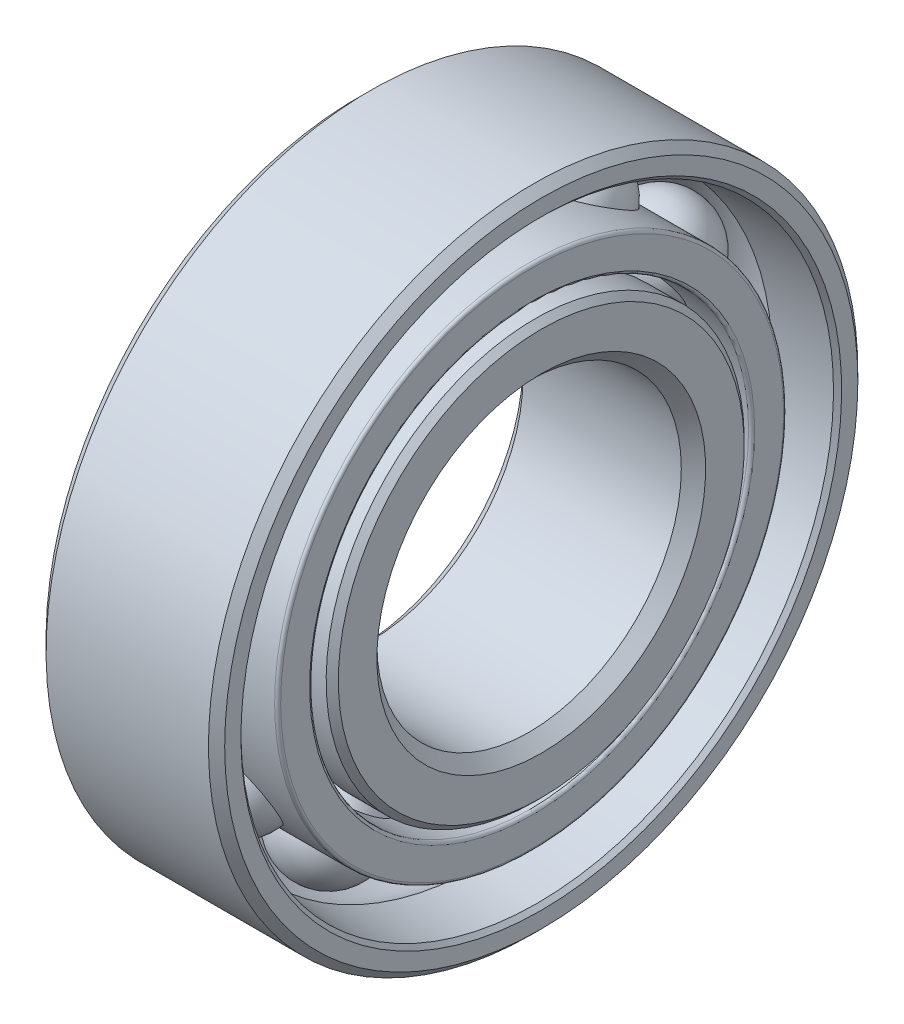
from build123d import *

# Parameters (mm, degrees)
CIRPATTERN1_COUNT   = 12
SKETCH6_R           = 12.54
SKETCH6_R_2         = 10.815
BOSS_EXTRUDE1_DEPTH = 4.05
CIRPATTERN2_COUNT   = 12
FILLET1_R           = 0.15


with BuildPart() as part:
    # Sketch3 → Revolve1 (revolve)
    with BuildSketch(Plane.XY, mode=Mode.PRIVATE) as revolve1_sk:
        with BuildLine():
            Line((4.1, 16), (-3.9, 16))
            Line((-3.9, 16), (-4.5, 15.4))
            Line((-4.5, 15.4), (-4.5, 13.5))
            Line((-4.5, 13.5), (-4.2, 13.2))
            Line((-4.2, 13.2), (-2.565891605, 13.2))
            ThreePointArc((-2.565891605, 13.2), (-1.511935823, 14.367227232), (0, 14.8))
            ThreePointArc((0, 14.8), (0.786327254, 14.689677077), (1.511935823, 14.367227232))
            Line((1.511935823, 14.367227232), (4.3, 14.6))
            Line((4.3, 14.6), (4.5, 14.8))
            Line((4.5, 14.8), (4.5, 15.6))
            Line((4.5, 15.6), (4.1, 16))
        make_face()
        with BuildLine():
            Line((3.9, 7.5), (-3.9, 7.5))
            Line((-3.9, 7.5), (-4.5, 8.1))
            Line((-4.5, 8.1), (-4.5, 10))
            Line((-4.5, 10), (-4.2, 10.3))
            Line((-4.2, 10.3), (-2.338148144, 10.3))
            ThreePointArc((-2.338148144, 10.3), (0, 9.085125168), (2.338148144, 10.3))
            Line((2.338148144, 10.3), (4.2, 10.3))
            Line((4.2, 10.3), (4.5, 10))
            Line((4.5, 10), (4.5, 8.1))
            Line((4.5, 8.1), (3.9, 7.5))
        make_face()
    revolve(revolve1_sk.sketch.rotate(Axis((-4.5, 0, 0), (1, 0, 0)), 180), axis=Axis((-4.5, 0, 0), (1, 0, 0)))


with BuildPart() as body_2:
    # Sketch5 → Revolve2 (revolve)
    with BuildSketch(Plane.XY):
        with BuildLine():
            Line((0, 14.323562584), (0, 9.561562584))
            ThreePointArc((0, 9.561562584), (2.381, 11.942562584), (0, 14.323562584))
        make_face()
    revolve(axis=Axis((0, -16, 0), (0, 1, 0)))


with BuildPart() as cirpattern1_1:
    # CirPattern1: pattern copy
    add(body_2.part.rotate(Axis((0, 0, 0), (1, 0, 0)), 1 * 360 / CIRPATTERN1_COUNT))


with BuildPart() as cirpattern1_2:
    # CirPattern1: pattern copy
    add(body_2.part.rotate(Axis((0, 0, 0), (1, 0, 0)), 2 * 360 / CIRPATTERN1_COUNT))


with BuildPart() as cirpattern1_3:
    # CirPattern1: pattern copy
    add(body_2.part.rotate(Axis((0, 0, 0), (1, 0, 0)), 3 * 360 / CIRPATTERN1_COUNT))


with BuildPart() as cirpattern1_4:
    # CirPattern1: pattern copy
    add(body_2.part.rotate(Axis((0, 0, 0), (1, 0, 0)), 4 * 360 / CIRPATTERN1_COUNT))


with BuildPart() as cirpattern1_5:
    # CirPattern1: pattern copy
    add(body_2.part.rotate(Axis((0, 0, 0), (1, 0, 0)), 5 * 360 / CIRPATTERN1_COUNT))


with BuildPart() as cirpattern1_6:
    # CirPattern1: pattern copy
    add(body_2.part.rotate(Axis((0, 0, 0), (1, 0, 0)), 6 * 360 / CIRPATTERN1_COUNT))


with BuildPart() as cirpattern1_7:
    # CirPattern1: pattern copy
    add(body_2.part.rotate(Axis((0, 0, 0), (1, 0, 0)), 7 * 360 / CIRPATTERN1_COUNT))


with BuildPart() as cirpattern1_8:
    # CirPattern1: pattern copy
    add(body_2.part.rotate(Axis((0, 0, 0), (1, 0, 0)), 8 * 360 / CIRPATTERN1_COUNT))


with BuildPart() as cirpattern1_9:
    # CirPattern1: pattern copy
    add(body_2.part.rotate(Axis((0, 0, 0), (1, 0, 0)), 9 * 360 / CIRPATTERN1_COUNT))


with BuildPart() as cirpattern1_10:
    # CirPattern1: pattern copy
    add(body_2.part.rotate(Axis((0, 0, 0), (1, 0, 0)), 10 * 360 / CIRPATTERN1_COUNT))


with BuildPart() as cirpattern1_11:
    # CirPattern1: pattern copy
    add(body_2.part.rotate(Axis((0, 0, 0), (1, 0, 0)), 11 * 360 / CIRPATTERN1_COUNT))


with BuildPart() as body_14:
    # Sketch6 → Boss-Extrude1 (new, symmetric)
    with BuildSketch(Plane(origin=(0, 0, 0), x_dir=(0, 0, -1), z_dir=(1, 0, 0))):
        Circle(SKETCH6_R)
        Circle(SKETCH6_R_2, mode=Mode.SUBTRACT)
    extrude(amount=BOSS_EXTRUDE1_DEPTH, both=True)

    # Sketch8 → Cut-Revolve1 (revolve, cut)
    with BuildSketch(Plane.XY):
        with BuildLine():
            Line((0, 9.551562584), (0, 14.333562584))
            ThreePointArc((0, 14.333562584), (2.391, 11.942562584), (0, 9.551562584))
        make_face()
    cut_revolve1 = revolve(axis=Axis((0, -16, 0), (0, 1, 0)), mode=Mode.SUBTRACT)

    # CirPattern2: Cut-Revolve1 ×12 about axis
    cirpattern2_axis = Axis((0, 0, 0), (1, 0, 0))
    for i in range(1, CIRPATTERN2_COUNT):
        add(cut_revolve1.rotate(cirpattern2_axis, i * 360 / CIRPATTERN2_COUNT), mode=Mode.SUBTRACT)

    # Fillet1
    fillet1_edges = [body_14.edges().sort_by_distance(p)[0] for p in [
        (-4.05, 0, 12.54),
        (4.05, 0, 12.54),
        (-4.05, 0, 10.815),
        (4.05, 0, 10.815),
    ]]
    fillet(fillet1_edges, radius=FILLET1_R)


solid = Compound([part.part, body_2.part, cirpattern1_1.part, cirpattern1_2.part, cirpattern1_3.part, cirpattern1_4.part, cirpattern1_5.part, cirpattern1_6.part, cirpattern1_7.part, cirpattern1_8.part, cirpattern1_9.part, cirpattern1_10.part, cirpattern1_11.part, body_14.part])
